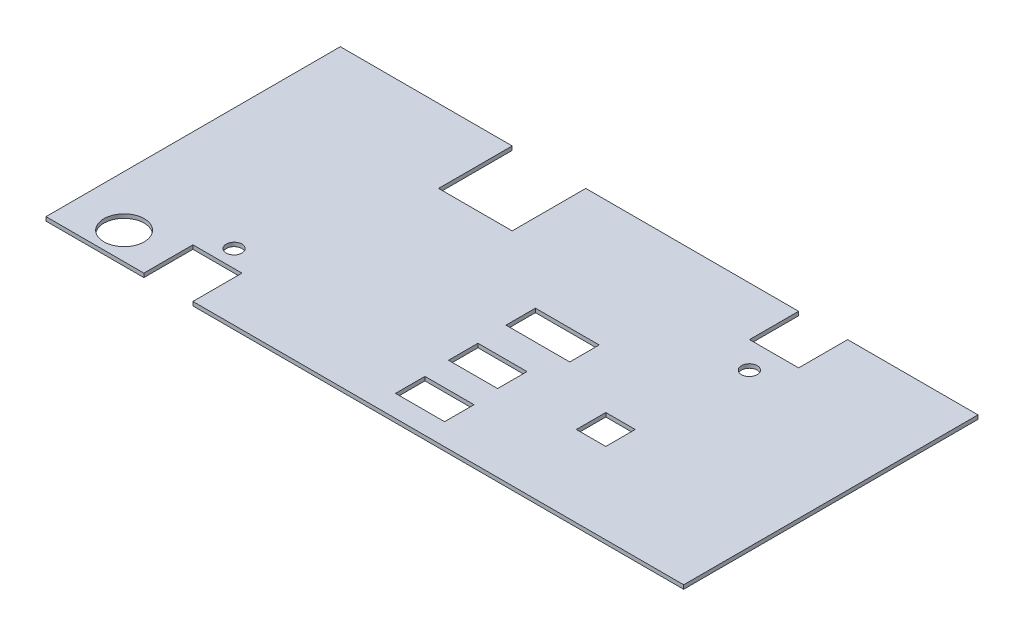
from build123d import *

# Parameters (mm, degrees)
SKETCH1_W           = 130
SKETCH1_H           = 60
BOSS_EXTRUDE1_DEPTH = 0.8
SKETCH2_W           = 10
SKETCH2_H           = 10
SKETCH2_W_2         = 15
SKETCH2_H_2         = 15
CUT_EXTRUDE5_DEPTH  = 3
SKETCH3_R           = 1.6
SKETCH3_R_2         = 4.1
CUT_EXTRUDE6_DEPTH  = 3
SKETCH4_W           = 13
SKETCH4_H           = 6
SKETCH4_W_2         = 10
SKETCH4_W_3         = 6
CUT_EXTRUDE8_DEPTH  = 3


with BuildPart() as part:
    # Sketch1 → Boss-Extrude1 (new body)
    with BuildSketch(Plane(origin=(0, 0, 0), x_dir=(1, 0, 0), z_dir=(0, 1, 0))):
        Rectangle(SKETCH1_W, SKETCH1_H)
    extrude(amount=BOSS_EXTRUDE1_DEPTH)

    # Sketch2 → Cut-Extrude5 (cut)
    with BuildSketch(Plane(origin=(0, 0, 0), x_dir=(1, 0, 0), z_dir=(0, 1, 0))):
        with Locations((-40.048834012, -25)):
            Rectangle(SKETCH2_W, SKETCH2_H)
        with Locations((33.42564803, 25.004850698)):
            Rectangle(SKETCH2_W, SKETCH2_H)
        with Locations((-22.460867384, 22.5)):
            Rectangle(SKETCH2_W_2, SKETCH2_H_2)
    extrude(amount=CUT_EXTRUDE5_DEPTH, mode=Mode.SUBTRACT)

    # Sketch3 → Cut-Extrude6 (cut)
    with BuildSketch(Plane(origin=(0, 0.8, 0), x_dir=(1, 0, 0), z_dir=(0, 1, 0))):
        with Locations(Location((-40.185122934, -16.467769304, 0), (0, 0, 270))):
            Circle(SKETCH3_R)
        with Locations(Location((33.794766004, 14.590842962, 0), (0, 0, 270))):
            Circle(SKETCH3_R)
        with Locations(Location((-54.63600503, -24.448107178, 0), (0, 0, 270))):
            Circle(SKETCH3_R_2)
    extrude(amount=-CUT_EXTRUDE6_DEPTH, mode=Mode.SUBTRACT)

    # Sketch4 → Cut-Extrude8 (cut)
    with BuildSketch(Plane(origin=(0, 0, 0), x_dir=(1, 0, 0), z_dir=(0, 1, 0))):
        with Locations((7.547565178, 0.728562609)):
            Rectangle(SKETCH4_W, SKETCH4_H)
        with Locations((6.386143638, -11.327057027)):
            Rectangle(SKETCH4_W_2, SKETCH4_H)
        with Locations((6.830928235, -22.580107336)):
            Rectangle(SKETCH4_W_2, SKETCH4_H)
        with Locations((29.640312606, -10.519923454)):
            Rectangle(SKETCH4_W_3, SKETCH4_H)
    extrude(amount=CUT_EXTRUDE8_DEPTH, mode=Mode.SUBTRACT)


solid = part.part
